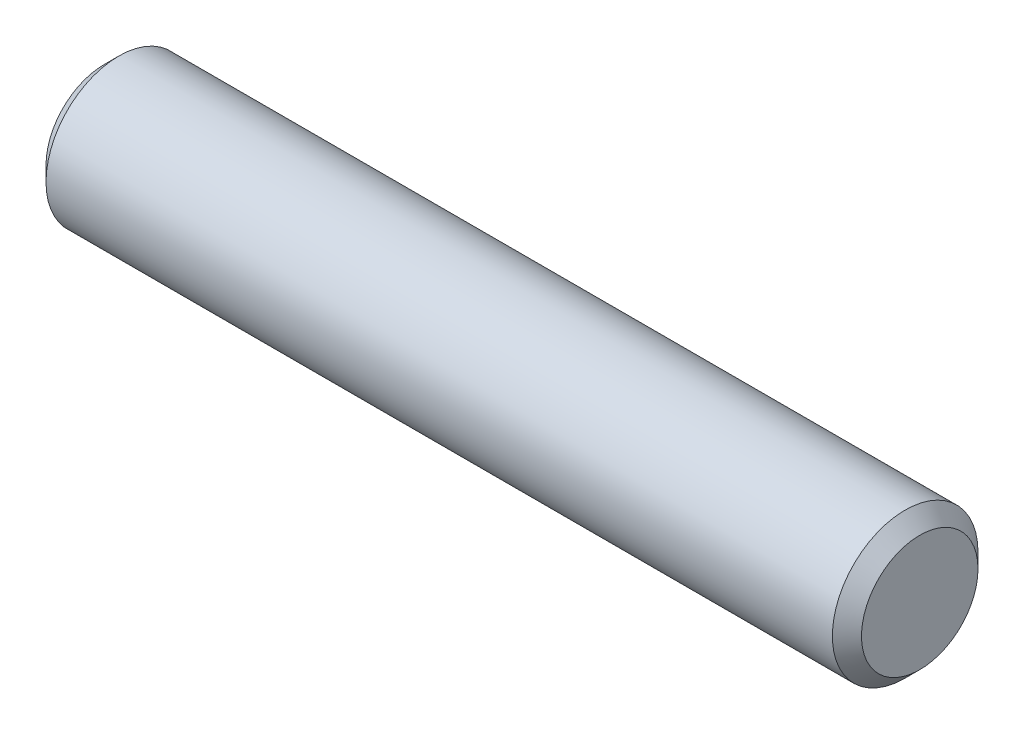
from build123d import *

# Parameters (mm, degrees)
SKETCH1_W     = 28
SKETCH1_H     = 2.5
CHAMFER1_SIZE = 0.5


with BuildPart() as part:
    # Sketch1 → Revolve1 (revolve)
    with BuildSketch(Plane(origin=(0, 0, 0), x_dir=(1, 0, 0), z_dir=(0, 1, 0))):
        with Locations((-14, 1.25)):
            Rectangle(SKETCH1_W, SKETCH1_H)
    revolve(axis=Axis((0, 0, 0), (-1, 0, 0)))

    # Chamfer1
    chamfer1_edges = [part.edges().sort_by_distance(p)[0] for p in [
        (-28, 0, 2.5),
        (0, 0, 2.5),
    ]]
    chamfer(chamfer1_edges, length=CHAMFER1_SIZE)


solid = part.part
